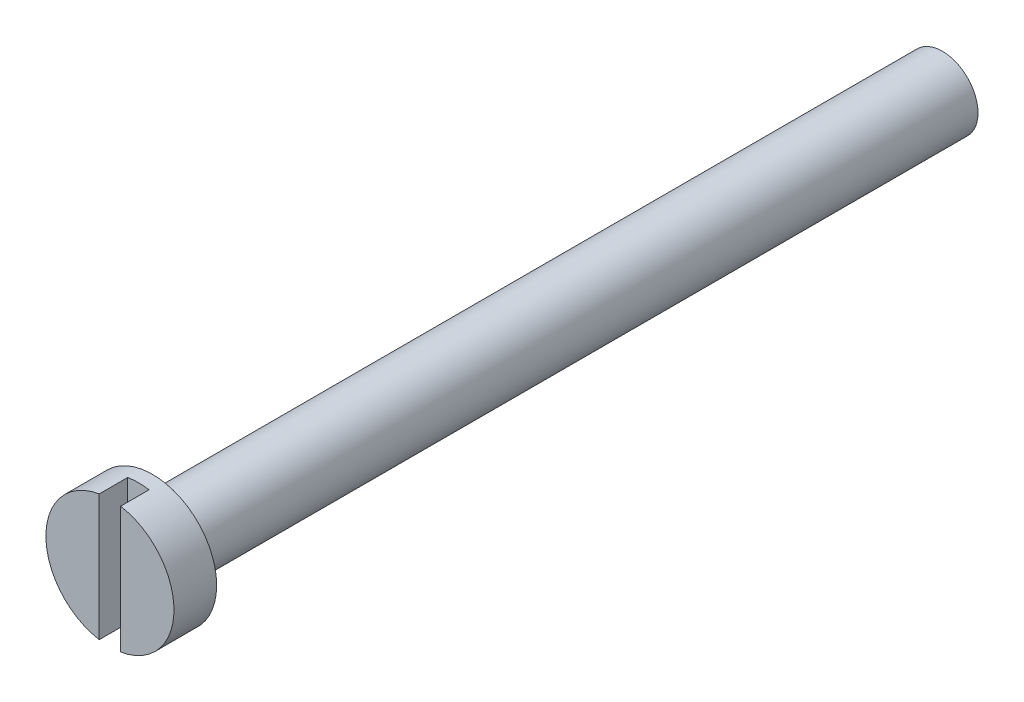
from build123d import *

# Parameters (mm, degrees)
SKETCH_1_R             = 2.5
EXTRUDE_1_DEPTH        = 55.5
SKETCH_2_R             = 4.5
EXTRUDE_2_DEPTH        = 3
SKETCH_4_W             = 1.5
SKETCH_4_H             = 10.936891942
CUT_EXTRUDE_1_DEPTH    = 2
HOLE_WIZARD_M3_1_D     = 2.5
HOLE_WIZARD_M3_1_DEPTH = 10
HOLE_WIZARD_M3_1_TIP   = 0.751075774


with BuildPart() as part:
    # 草图1 → 凸台-拉伸1 (new body)
    with BuildSketch(Plane.XY):
        Circle(SKETCH_1_R)
    extrude(amount=EXTRUDE_1_DEPTH)

    # 草图2 → 凸台-拉伸2 (add)
    with BuildSketch(Plane.XY.offset(55.5)):
        Circle(SKETCH_2_R)
    extrude(amount=EXTRUDE_2_DEPTH)

    # 草图4 → 切除-拉伸1 (cut)
    with BuildSketch(Plane.XY.offset(58.5)):
        Rectangle(SKETCH_4_W, SKETCH_4_H)
    extrude(amount=-CUT_EXTRUDE_1_DEPTH, mode=Mode.SUBTRACT)

    # M3 螺纹孔的螺纹孔钻头1
    with Locations(Plane(origin=(0, 0, 0), x_dir=(-1, 0, 0), z_dir=(0, 0, -1))):
        with Locations((0, 0)):
            Hole(HOLE_WIZARD_M3_1_D / 2, depth=HOLE_WIZARD_M3_1_DEPTH)
            with Locations((0, 0, -(HOLE_WIZARD_M3_1_DEPTH + HOLE_WIZARD_M3_1_TIP / 2))):  # 118° drill point
                Cone(0, HOLE_WIZARD_M3_1_D / 2, HOLE_WIZARD_M3_1_TIP, mode=Mode.SUBTRACT)


solid = part.part
